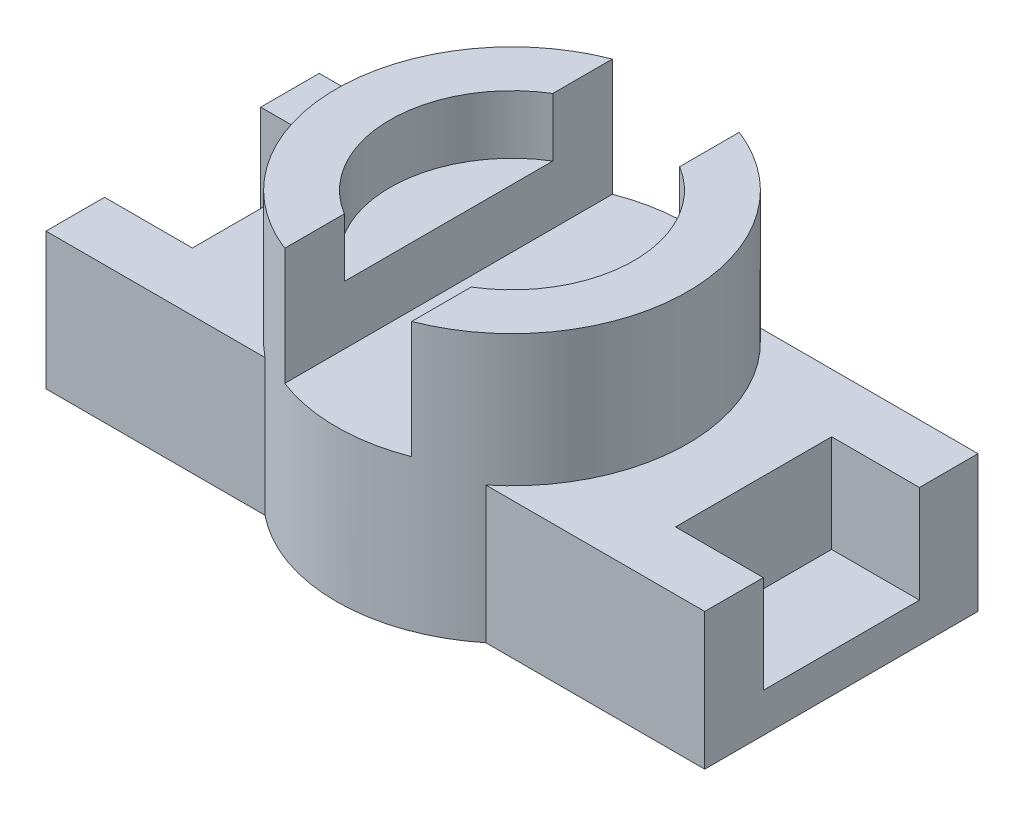
from build123d import *

# Parameters (mm, degrees)
BOSS_EXTRUDE1_DEPTH   = 28
BOSS_EXTRUDE1_2_DEPTH = 28
SKETCH1_3_R           = 36
BOSS_EXTRUDE2_DEPTH   = 55
CUT_EXTRUDE1_START    = 55
SKETCH1_4_R           = 25
CUT_EXTRUDE1_DEPTH    = 12
CUT_EXTRUDE2_START    = 31
SKETCH1_5_W           = 26
SKETCH1_5_H           = 85.646984924
CUT_EXTRUDE2_DEPTH    = 64.21915941
SKETCH2_W             = 18
SKETCH2_H             = 32
CUT_EXTRUDE3_DEPTH    = 20


with BuildPart() as part:
    # Sketch1 → Boss-Extrude1 (new body)
    with BuildSketch(Plane(origin=(0, 0, 0), x_dir=(1, 0, 0), z_dir=(0, 1, 0))):
        with BuildLine():
            Line((-67.5, 28), (-67.5, -28))
            Line((-67.5, -28), (-22.627416998, -28))
            ThreePointArc((-22.627416998, -28), (-36, 0), (-22.627416998, 28))
            Line((-22.627416998, 28), (-67.5, 28))
        make_face()
    extrude(amount=BOSS_EXTRUDE1_DEPTH)



with BuildPart() as body_2:
    # Sketch1 → Boss-Extrude1 2 (new body)
    with BuildSketch(Plane(origin=(0, 0, 0), x_dir=(1, 0, 0), z_dir=(0, 1, 0))):
        with BuildLine():
            ThreePointArc((22.627416998, 28), (36, 0), (22.627416998, -28))
            Line((22.627416998, -28), (67.5, -28))
            Line((67.5, -28), (67.5, 28))
            Line((67.5, 28), (22.627416998, 28))
        make_face()
    extrude(amount=BOSS_EXTRUDE1_2_DEPTH)


with BuildPart() as part_1:
    add(part.part)

    add(body_2.part)  # Boss-Extrude2 merges body 2
    # Sketch1<3> → Boss-Extrude2 (add)
    with BuildSketch(Plane(origin=(0, 0, 0), x_dir=(1, 0, 0), z_dir=(0, 1, 0))):
        Circle(SKETCH1_3_R)
    extrude(amount=BOSS_EXTRUDE2_DEPTH)

    # Sketch1<4> → Cut-Extrude1 (cut)
    with BuildSketch(Plane(origin=(0, 0, 0), x_dir=(1, 0, 0), z_dir=(0, 1, 0)).offset(CUT_EXTRUDE1_START)):
        Circle(SKETCH1_4_R)
    extrude(amount=-CUT_EXTRUDE1_DEPTH, mode=Mode.SUBTRACT)

    # Sketch1<5> → Cut-Extrude2 (cut, through all)
    with BuildSketch(Plane(origin=(0, 0, 0), x_dir=(1, 0, 0), z_dir=(0, 1, 0)).offset(CUT_EXTRUDE2_START)):
        Rectangle(SKETCH1_5_W, SKETCH1_5_H)
    extrude(amount=CUT_EXTRUDE2_DEPTH, mode=Mode.SUBTRACT)

    # Sketch2 → Cut-Extrude3 (cut)
    with BuildSketch(Plane(origin=(0, 28, 0), x_dir=(1, 0, 0), z_dir=(0, 1, 0))):
        with Locations((-58.5, 0)):
            Rectangle(SKETCH2_W, SKETCH2_H)
        with Locations((58.5, 0)):
            Rectangle(SKETCH2_W, SKETCH2_H)
    extrude(amount=-CUT_EXTRUDE3_DEPTH, mode=Mode.SUBTRACT)


solid = part_1.part
